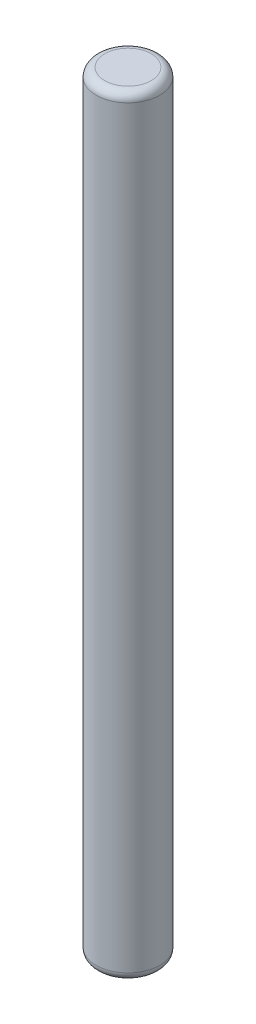
from build123d import *

# Parameters (mm, degrees)
SKETCH_1_R      = 0.375
EXTRUDE_1_DEPTH = 9.1
FILLET_1_R      = 0.1


with BuildPart() as part:
    # Эскиз1 → Бобышка-Вытянуть1 (new body)
    with BuildSketch(Plane(origin=(0, 0, 0), x_dir=(1, 0, 0), z_dir=(0, 1, 0))):
        with Locations(Location((0, 0, 0), (0, 0, 270))):
            Circle(SKETCH_1_R)
    extrude(amount=EXTRUDE_1_DEPTH)

    # Скругление1
    fillet_1_edges = [part.edges().sort_by_distance(p)[0] for p in [
        (0, 0, -0.375),
        (0, 9.1, -0.375),
    ]]
    fillet(fillet_1_edges, radius=FILLET_1_R)


solid = part.part
